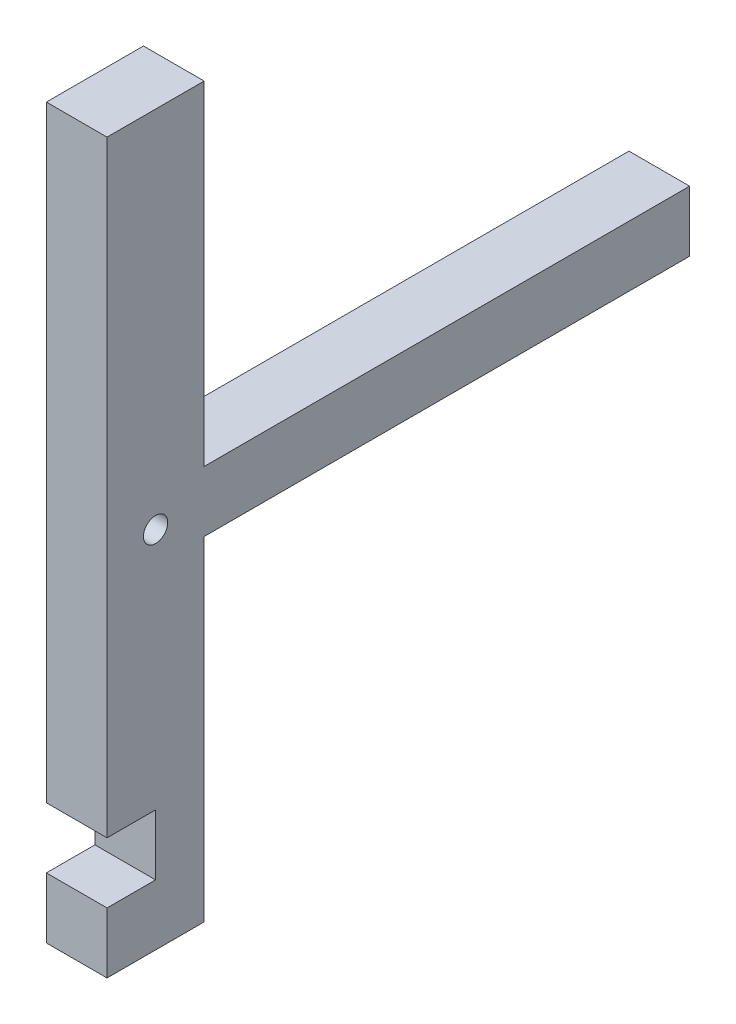
from build123d import *

# Parameters (mm, degrees)
ELEVATOR_PADDLE_R   = 1.27
BOSS_EXTRUDE1_DEPTH = 6.35


with BuildPart() as part:
    # Elevator Paddle → Boss-Extrude1 (new body)
    with BuildSketch(Plane(origin=(0, 0, 0), x_dir=(0, 0, -1), z_dir=(1, 0, 0))):
        Polygon((-5.08, -25.4), (-5.08, 38.1), (5.08, 38.1), (5.08, 3.175), (55.88, 3.175), (55.88, -3.175), (5.08, -3.175), (5.08, -38.1), (-5.08, -38.1), (-5.08, -31.75), (0, -31.75), (0, -25.4), align=None)
        Circle(ELEVATOR_PADDLE_R, mode=Mode.SUBTRACT)
    extrude(amount=BOSS_EXTRUDE1_DEPTH)


solid = part.part
